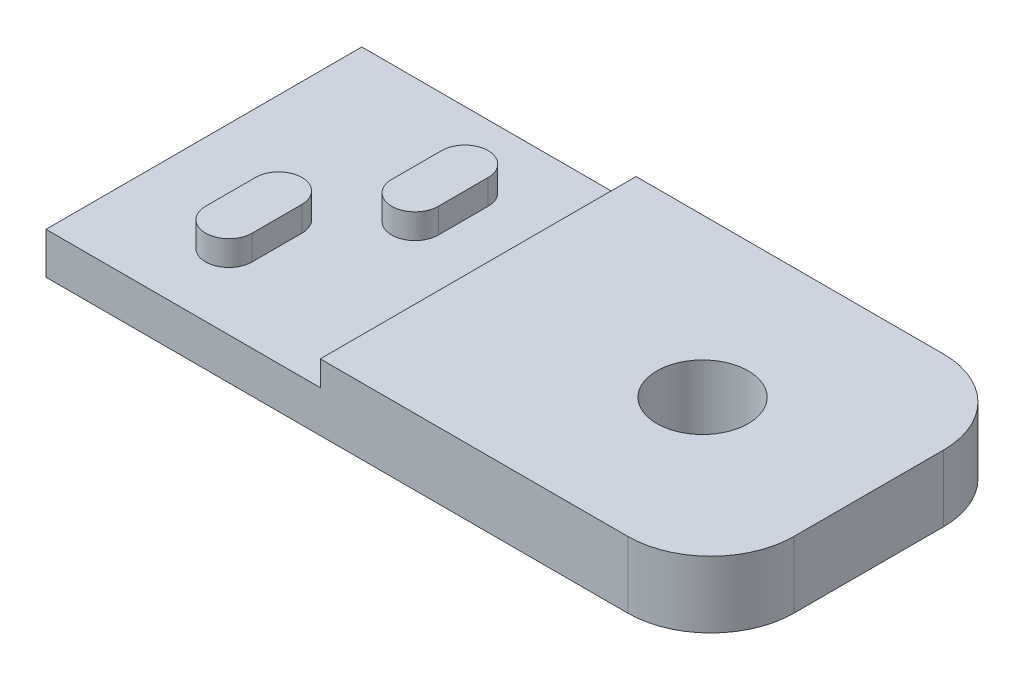
from build123d import *

# Parameters (mm, degrees)
SKETCH1_W           = 40
SKETCH1_H           = 19
BOSS_EXTRUDE1_DEPTH = 4
CUT_EXTRUDE1_REACH  = 24.5
SKETCH2_R           = 2.75
SKETCH4_W           = 16.5
SKETCH4_H           = 19
CUT_EXTRUDE2_DEPTH  = 1.5
FILLET1_R           = 5


with BuildPart() as part:
    # Sketch1 → Boss-Extrude1 (new body)
    with BuildSketch(Plane(origin=(0, 0, 0), x_dir=(1, 0, 0), z_dir=(0, 1, 0))):
        Rectangle(SKETCH1_W, SKETCH1_H)
    extrude(amount=BOSS_EXTRUDE1_DEPTH)

    # Sketch2 → Cut-Extrude1 (cut, up to next)
    with BuildSketch(Plane(origin=(0, 4, 0), x_dir=(1, 0, 0), z_dir=(0, 1, 0)), mode=Mode.PRIVATE) as cut_extrude1_sk1:
        with Locations(Location((10, 0, 0), (0, 0, 270))):
            Circle(SKETCH2_R)
    cut_extrude1_tool1 = extrude(cut_extrude1_sk1.sketch, amount=-CUT_EXTRUDE1_REACH, mode=Mode.PRIVATE) & part.part
    add(cut_extrude1_tool1.solids().sort_by_distance((10, 4, 0))[0], mode=Mode.SUBTRACT)

    # Sketch4 → Cut-Extrude2 (cut)
    with BuildSketch(Plane(origin=(0, 4, 0), x_dir=(1, 0, 0), z_dir=(0, 1, 0))):
        with Locations((-11.75, 0)):
            Rectangle(SKETCH4_W, SKETCH4_H)
        with BuildLine():
            Line((-7.9, 5), (-7.9, 2))
            ThreePointArc((-7.9, 2), (-9.3, 0.6), (-10.7, 2))
            Line((-10.7, 2), (-10.7, 5))
            ThreePointArc((-10.7, 5), (-9.3, 6.4), (-7.9, 5))
        make_face(mode=Mode.SUBTRACT)
        with BuildLine():
            Line((-12.1, -2), (-12.1, -5))
            ThreePointArc((-12.1, -5), (-13.5, -6.4), (-14.9, -5))
            Line((-14.9, -5), (-14.9, -2))
            ThreePointArc((-14.9, -2), (-13.5, -0.6), (-12.1, -2))
        make_face(mode=Mode.SUBTRACT)
    extrude(amount=-CUT_EXTRUDE2_DEPTH, mode=Mode.SUBTRACT)

    # Fillet1
    fillet1_edges = [part.edges().sort_by_distance(p)[0] for p in [
        (20, 2, 9.5),
        (20, 2, -9.5),
    ]]
    fillet(fillet1_edges, radius=FILLET1_R)


solid = part.part
